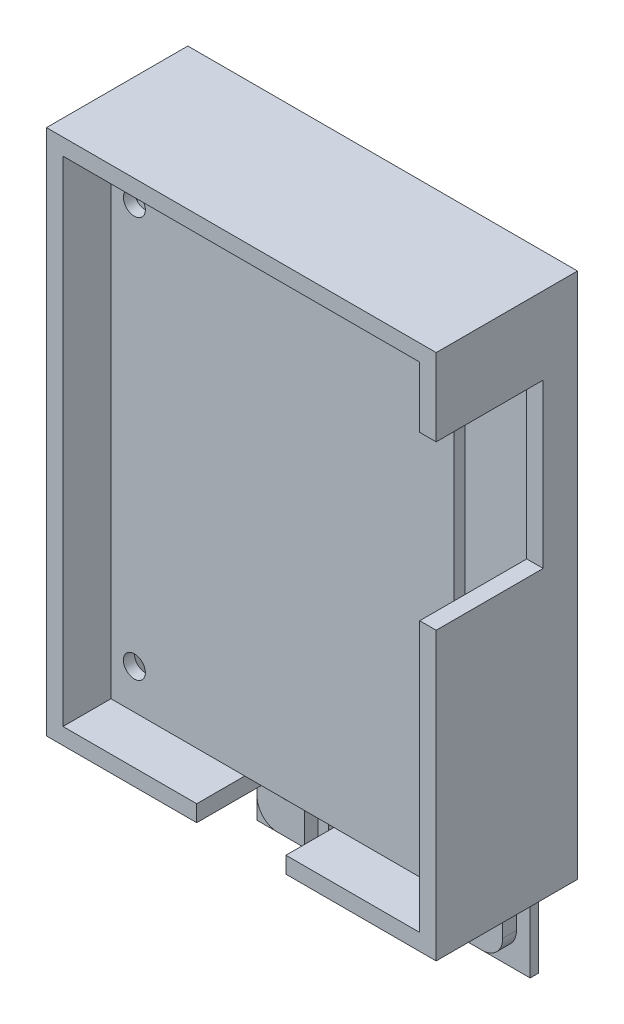
from build123d import *

# Parameters (mm, degrees)
SKETCH1_W               = 50
SKETCH1_H               = 70
SKETCH1_R               = 1.6
BOSS_EXTRUDE1_DEPTH     = 1.6
SKETCH2_W               = 56.8
SKETCH2_H               = 76.8
SKETCH2_W_2             = 52
SKETCH2_H_2             = 72
BOSS_EXTRUDE2_DEPTH     = 20.2
BOSS_EXTRUDE3_START     = 2
SKETCH3_W               = 56.8
SKETCH3_H               = 76.8
SKETCH3_R               = 1.6
BOSS_EXTRUDE3_DEPTH     = 2
SKETCH4_W               = 35
SKETCH4_H               = 18
BOSS_EXTRUDE4_DEPTH     = 1
CUT_EXTRUDE1_DEPTH      = 2
CUT_EXTRUDE1_DEPTH_BACK = 69.169494644
SKETCH5_W               = 5
SKETCH5_H               = 15
SKETCH6_W               = 13
SKETCH6_H               = 15.6
CUT_EXTRUDE2_DEPTH      = 81.963448543
SKETCH7_W               = 15.6
SKETCH7_H               = 23.78
CUT_EXTRUDE3_DEPTH      = 69.169494644
SKETCH11_R              = 4
CUT_EXTRUDE5_DEPTH      = 52.857111373
SKETCH8_W               = 39.8
SKETCH8_H               = 16.5
SKETCH8_W_2             = 19
SKETCH8_H_2             = 13
BOSS_EXTRUDE5_DEPTH     = 1.2
SKETCH9_W               = 6.9
SKETCH9_H               = 12.5
BOSS_EXTRUDE6_DEPTH     = 2
SKETCH10_W              = 0.407051282
SKETCH10_H              = 3.175
CUT_EXTRUDE4_DEPTH      = 2
FILLET1_R               = 3
CHAMFER1_SIZE           = 1.6


with BuildPart() as part:
    # Sketch1 → Boss-Extrude1 (new body)
    with BuildSketch(Plane.XY):
        Rectangle(SKETCH1_W, SKETCH1_H)
        with Locations((-21.59, 29.21)):
            Circle(SKETCH1_R, mode=Mode.SUBTRACT)
        with Locations((21.59, 29.21)):
            Circle(SKETCH1_R, mode=Mode.SUBTRACT)
        with Locations((21.59, -29.21)):
            Circle(SKETCH1_R, mode=Mode.SUBTRACT)
        with Locations((-21.59, -29.21)):
            Circle(SKETCH1_R, mode=Mode.SUBTRACT)
    extrude(amount=BOSS_EXTRUDE1_DEPTH)


with BuildPart() as body_2:
    # Sketch2 → Boss-Extrude2 (new body)
    with BuildSketch(Plane.XY.offset(7.6)):
        Rectangle(SKETCH2_W, SKETCH2_H)
        Rectangle(SKETCH2_W_2, SKETCH2_H_2, mode=Mode.SUBTRACT)
    extrude(amount=-BOSS_EXTRUDE2_DEPTH)

    # Sketch3 → Boss-Extrude3 (add)
    with BuildSketch(Plane(origin=(0, 0, -12.6), x_dir=(-1, 0, 0), z_dir=(0, 0, -1)).offset(BOSS_EXTRUDE3_START)):
        Rectangle(SKETCH3_W, SKETCH3_H)
        with Locations((-21.59, -29.21)):
            Circle(SKETCH3_R, mode=Mode.SUBTRACT)
        with Locations((21.59, -29.21)):
            Circle(SKETCH3_R, mode=Mode.SUBTRACT)
        with Locations((21.59, 29.21)):
            Circle(SKETCH3_R, mode=Mode.SUBTRACT)
        with Locations((-21.59, 29.21)):
            Circle(SKETCH3_R, mode=Mode.SUBTRACT)
    extrude(amount=-BOSS_EXTRUDE3_DEPTH)

    # Sketch5 → Cut-Extrude1 (cut, two sides: drawn at the far end of the back side and taken through both)
    with BuildSketch(Plane(origin=(-26, 0, 0), x_dir=(0, 0, -1), z_dir=(1, 0, 0)).offset(-CUT_EXTRUDE1_DEPTH_BACK)):
        Polygon((14.9, 1.15), (14.9, 4.65), (5.7, 4.65), (5.7, 1.15), (5.7, -13.85), (14.9, -13.85), align=None)
        with Locations((3, 17.5)):
            Rectangle(SKETCH5_W, SKETCH5_H)
    extrude(amount=CUT_EXTRUDE1_DEPTH + CUT_EXTRUDE1_DEPTH_BACK, mode=Mode.SUBTRACT)

    # Sketch6 → Cut-Extrude2 (cut, through all)
    with BuildSketch(Plane(origin=(0, -36, 0), x_dir=(1, 0, 0), z_dir=(0, 1, 0))):
        with Locations((0, 0.2)):
            Rectangle(SKETCH6_W, SKETCH6_H)
    extrude(amount=-CUT_EXTRUDE2_DEPTH, mode=Mode.SUBTRACT)

    # Sketch7 → Cut-Extrude3 (cut, through all)
    with BuildSketch(Plane.ZY.offset(-26)):
        with Locations((-0.2, 15.24)):
            Rectangle(SKETCH7_W, SKETCH7_H)
    extrude(amount=-CUT_EXTRUDE3_DEPTH, mode=Mode.SUBTRACT)

    # Sketch11 → Cut-Extrude5 (cut, through all)
    with BuildSketch(Plane.XY.offset(-12.6)):
        with Locations((7.41, -4.35)):
            Circle(SKETCH11_R)
        Polygon((-24, 4.65), (-22.59, 4.65), (-22.59, -0.95), (-24, -2.36), align=None)
    extrude(amount=-CUT_EXTRUDE5_DEPTH, mode=Mode.SUBTRACT)

    # Chamfer1
    chamfer1_edges = [body_2.edges().sort_by_distance(p)[0] for p in [
        (-28.4, -26.125, -14.6),
        (0, 38.4, -14.6),
        (28.4, 0, -14.6),
        (0, -38.4, -14.6),
        (-28.4, 21.525, -14.6),
    ]]
    chamfer(chamfer1_edges, length=CHAMFER1_SIZE)


with BuildPart() as body_3:
    # Sketch4 → Boss-Extrude4 (new body)
    with BuildSketch(Plane(origin=(0, 0, -7.7), x_dir=(-1, 0, 0), z_dir=(0, 0, -1))):
        with Locations((8.09, -6.35)):
            Rectangle(SKETCH4_W, SKETCH4_H)
    extrude(amount=BOSS_EXTRUDE4_DEPTH)


with BuildPart() as body_4:
    # Sketch8 → Boss-Extrude5 (new body)
    with BuildSketch(Plane(origin=(0, 0, -14.6), x_dir=(-1, 0, 0), z_dir=(0, 0, -1))):
        with Locations((0, -47.65)):
            Rectangle(SKETCH8_W, SKETCH8_H)
        with Locations((0, -47.65)):
            Rectangle(SKETCH8_W_2, SKETCH8_H_2, mode=Mode.SUBTRACT)
    extrude(amount=BOSS_EXTRUDE5_DEPTH)

    # Sketch9 → Boss-Extrude6 (add)
    with BuildSketch(Plane(origin=(0, 0, -14.6), x_dir=(-1, 0, 0), z_dir=(0, 0, -1))):
        with Locations((-14.45, -47.65)):
            Rectangle(SKETCH9_W, SKETCH9_H)
        with Locations((14.45, -47.65)):
            Rectangle(SKETCH9_W, SKETCH9_H)
    extrude(amount=-BOSS_EXTRUDE6_DEPTH)

    # Sketch10 → Cut-Extrude4 (cut)
    # profile 1 of 3: a face of its own
    with BuildSketch(Plane.XY.offset(-12.6)):
        with Locations((-16.339423077, -47.5625)):
            Rectangle(SKETCH10_W, SKETCH10_H)
    # profile 2 of 3: a face of its own
    with BuildSketch(Plane.XY.offset(-12.6)):
        with BuildLine():
            Line((-12.391025641, -46.520703125), (-12.699494191, -46.789102564))
            add(Edge.make_bspline(
                [(-12.699494191, -46.789102564), (-12.747888684, -46.746844406), (-12.842100109, -46.664578822), (-12.989615296, -46.555910106), (-13.137955908, -46.46425102), (-13.287161224, -46.390695788), (-13.434712708, -46.331782865), (-13.581282721, -46.291280436), (-13.725705843, -46.264819586), (-13.821743922, -46.261549439), (-13.869130609, -46.259935897)],
                knots=[0, 0, 0, 0, 1.174203348, 2.285866929, 3.345479548, 4.357773815, 5.323690501, 6.245291137, 7.134199255, 8, 8, 8, 8], degree=3))
            add(Edge.make_bspline(
                [(-13.869130609, -46.259935897), (-13.896502226, -46.260364666), (-13.951159876, -46.261220863), (-14.032707543, -46.270025074), (-14.113460107, -46.283158189), (-14.193466729, -46.301953913), (-14.272896667, -46.325128846), (-14.351141919, -46.354682144), (-14.428683945, -46.389251682), (-14.50489428, -46.429034712), (-14.578967642, -46.47316709), (-14.649369098, -46.521737058), (-14.715659732, -46.57466575), (-14.777963772, -46.631803413), (-14.835915314, -46.693237261), (-14.890373169, -46.758083495), (-14.93992689, -46.827862241), (-14.985541091, -46.901070816), (-15.025766476, -46.977189293), (-15.061972202, -47.054385971), (-15.09177789, -47.13331553), (-15.115899491, -47.21371519), (-15.135111702, -47.295479799), (-15.149058295, -47.378519283), (-15.157688764, -47.463097199), (-15.158543252, -47.519866364), (-15.158974359, -47.548507612)],
                knots=[0, 0, 0, 0, 0.9732313, 1.943419598, 2.914105962, 3.881741322, 4.864768402, 5.855028487, 6.854206409, 7.882911434, 8.911035887, 9.919250175, 10.922630637, 11.925982763, 12.923451909, 13.924676513, 14.935397504, 15.964931351, 16.990480746, 17.995899336, 18.995873688, 19.988284801, 20.979664002, 21.981342857, 22.981544644, 24, 24, 24, 24], degree=3))
            add(Edge.make_bspline(
                [(-15.158974359, -47.548507612), (-15.158245226, -47.577779412), (-15.15678947, -47.636222292), (-15.148707343, -47.723217614), (-15.133910858, -47.808613532), (-15.113357604, -47.8925063), (-15.087390407, -47.974999005), (-15.055543286, -48.056304095), (-15.016962026, -48.135606815), (-14.974176127, -48.213635794), (-14.926028624, -48.288523646), (-14.872862638, -48.359111658), (-14.816473105, -48.426311608), (-14.755167368, -48.488252735), (-14.690793325, -48.547007547), (-14.621106682, -48.599993007), (-14.548065528, -48.649813499), (-14.471183347, -48.694945749), (-14.391140593, -48.734748668), (-14.309264167, -48.769867738), (-14.225286582, -48.799228687), (-14.139726469, -48.823429476), (-14.052135004, -48.84183213), (-13.963147764, -48.855038018), (-13.872274966, -48.863830527), (-13.811061736, -48.864649637), (-13.780088141, -48.865064103)],
                knots=[0, 0, 0, 0, 0.993588149, 1.983757546, 2.962012758, 3.932297264, 4.913089422, 5.895147596, 6.892791648, 7.904042674, 8.913936126, 9.911190904, 10.901569418, 11.888649192, 12.866825019, 13.856968273, 14.856789458, 15.866221433, 16.879824684, 17.888846278, 18.887838639, 19.896937192, 20.90452114, 21.923117541, 22.949107649, 24, 24, 24, 24], degree=3))
            add(Edge.make_bspline(
                [(-13.780088141, -48.865064103), (-13.741464588, -48.864194907), (-13.665278177, -48.862480386), (-13.553448072, -48.849351694), (-13.445910474, -48.829080689), (-13.343761098, -48.797574893), (-13.24537113, -48.760101451), (-13.152208331, -48.712364229), (-13.063157186, -48.657014753), (-12.980131245, -48.592796348), (-12.902755833, -48.523629006), (-12.833850172, -48.449166216), (-12.77222799, -48.3718239), (-12.720273618, -48.28974464), (-12.675176097, -48.20522894), (-12.639452871, -48.11649493), (-12.611761863, -48.024296648), (-12.600309839, -47.960783316), (-12.594551282, -47.928846154)],
                knots=[0, 0, 0, 0, 1.125101743, 2.219305524, 3.276925285, 4.308813505, 5.329771737, 6.340890082, 7.353855978, 8.380572537, 9.395307413, 10.374367262, 11.333343716, 12.272376171, 13.200803521, 14.12078735, 15.055053215, 16, 16, 16, 16], degree=3))
            Line((-12.594551282, -47.928846154), (-13.612179487, -47.928846154))
            Line((-13.612179487, -47.928846154), (-13.612179487, -47.5625))
            Line((-13.612179487, -47.5625), (-12.1875, -47.5625))
            add(Edge.make_bspline(
                [(-12.1875, -47.5625), (-12.188942806, -47.625326765), (-12.191759325, -47.747971664), (-12.214370672, -47.92674703), (-12.247710003, -48.095804763), (-12.296418208, -48.254431711), (-12.358134647, -48.402851437), (-12.433511688, -48.541067463), (-12.522401246, -48.669039516), (-12.624203716, -48.786045972), (-12.737383447, -48.890999233), (-12.860740101, -48.982910906), (-12.994826712, -49.059194856), (-13.137930707, -49.122568541), (-13.290844384, -49.171534575), (-13.45317402, -49.206216816), (-13.625173198, -49.227672173), (-13.743134757, -49.230143207), (-13.803620793, -49.231410256)],
                knots=[0, 0, 0, 0, 1.147910205, 2.240849596, 3.288798376, 4.293882934, 5.268269983, 6.221997348, 7.165762291, 8.110600512, 9.051082397, 9.981847279, 10.915696266, 11.864665164, 12.837641225, 13.844673414, 14.894833504, 16, 16, 16, 16], degree=3))
            add(Edge.make_bspline(
                [(-13.803620793, -49.231410256), (-13.839249951, -49.230889531), (-13.909728225, -49.229859481), (-14.013921089, -49.222642072), (-14.115444519, -49.211489011), (-14.213878823, -49.194746296), (-14.309755641, -49.174032397), (-14.402294223, -49.147541088), (-14.492753762, -49.11818645), (-14.57953376, -49.081898336), (-14.664482687, -49.042958987), (-14.746191768, -48.998145001), (-14.824735972, -48.9482294), (-14.901777827, -48.895187647), (-14.974356492, -48.835668404), (-15.044906262, -48.772515836), (-15.112340109, -48.704448976), (-15.154768209, -48.656038601), (-15.176146835, -48.631645633)],
                knots=[0, 0, 0, 0, 1.103516608, 2.18287355, 3.233646581, 4.265703846, 5.274262808, 6.270085734, 7.246073526, 8.217965859, 9.181570311, 10.139587173, 11.101556858, 12.063436887, 13.034641265, 14.006444858, 14.995489556, 16, 16, 16, 16], degree=3))
            add(Edge.make_bspline(
                [(-15.176146835, -48.631645633), (-15.207478601, -48.593010216), (-15.269469058, -48.516569354), (-15.347580219, -48.392749661), (-15.416155976, -48.266007774), (-15.470672589, -48.133681312), (-15.513503138, -47.997061127), (-15.544220569, -47.855772078), (-15.562090333, -47.709880692), (-15.564705439, -47.611097413), (-15.566025641, -47.561227965)],
                knots=[0, 0, 0, 0, 1.024988564, 2.027958144, 3.013741914, 3.99376912, 4.974186348, 5.962951834, 6.97162285, 8, 8, 8, 8], degree=3))
            add(Edge.make_bspline(
                [(-15.566025641, -47.561227965), (-15.565550075, -47.523883882), (-15.564607675, -47.449881412), (-15.552918152, -47.339916789), (-15.536155702, -47.231718702), (-15.511937064, -47.125458053), (-15.480650864, -47.021351494), (-15.442192343, -46.919249529), (-15.397297262, -46.818795567), (-15.344838763, -46.721214569), (-15.28774529, -46.626527708), (-15.223580606, -46.537676528), (-15.155633443, -46.452988459), (-15.081525071, -46.374496594), (-15.00338193, -46.300016939), (-14.918938885, -46.23216848), (-14.829946091, -46.168935429), (-14.735639042, -46.111835031), (-14.637556347, -46.06052274), (-14.535905997, -46.015519807), (-14.430886539, -45.978485363), (-14.323229575, -45.946696043), (-14.212100606, -45.923576561), (-14.098079565, -45.906504759), (-13.980879481, -45.895024267), (-13.901594829, -45.894071556), (-13.861498397, -45.893589744)],
                knots=[0, 0, 0, 0, 1.010042427, 2.001538926, 2.988977894, 3.97147212, 4.947868168, 5.928132478, 6.921817128, 7.922678872, 8.924230854, 9.911186466, 10.885946514, 11.860014231, 12.829900618, 13.804660667, 14.788293046, 15.781961137, 16.785220236, 17.781814947, 18.787040195, 19.796447094, 20.816926666, 21.855387176, 22.915410262, 24, 24, 24, 24], degree=3))
            add(Edge.make_bspline(
                [(-13.861498397, -45.893589744), (-13.827781485, -45.894187922), (-13.760714859, -45.895377763), (-13.660920791, -45.901569712), (-13.562602489, -45.912965391), (-13.465976697, -45.929956582), (-13.37046623, -45.949773084), (-13.276952164, -45.975495972), (-13.185070524, -46.005475336), (-13.094370074, -46.039913106), (-13.004475942, -46.079400557), (-12.91513592, -46.124561041), (-12.82673146, -46.176520393), (-12.738330295, -46.233642596), (-12.65048598, -46.296725196), (-12.563338332, -46.365806519), (-12.475830857, -46.439928204), (-12.419596882, -46.493489707), (-12.391025641, -46.520703125)],
                knots=[0, 0, 0, 0, 0.985310127, 1.959889608, 2.920407961, 3.875718043, 4.825872088, 5.769643135, 6.708031182, 7.649175746, 8.603380435, 9.575831151, 10.572468945, 11.59831001, 12.650450436, 13.731164539, 14.847254788, 16, 16, 16, 16], degree=3))
        make_face()
    # profile 3 of 3: a face of its own
    with BuildSketch(Plane.XY.offset(-12.6)):
        Polygon((14.479967949, -45.975), (15.965705128, -49.15), (15.547841546, -49.15), (15.065740184, -48.132371795), (13.766992188, -48.132371795), (13.284890825, -49.15), (12.872115385, -49.15), (14.352764423, -45.975), align=None)
        Polygon((14.416366186, -46.668895232), (13.922180489, -47.766025641), (14.915640024, -47.766025641), align=None, mode=Mode.SUBTRACT)
    extrude(amount=-CUT_EXTRUDE4_DEPTH, mode=Mode.SUBTRACT)

    # Fillet1
    fillet1_edges = [body_4.edges().sort_by_distance(p)[0] for p in [
        (17.9, -53.9, -13.6),
        (17.9, -41.4, -13.6),
        (-17.9, -41.4, -13.6),
        (-17.9, -53.9, -13.6),
    ]]
    fillet(fillet1_edges, radius=FILLET1_R)


solid = Compound([part.part, body_2.part, body_3.part, body_4.part])
